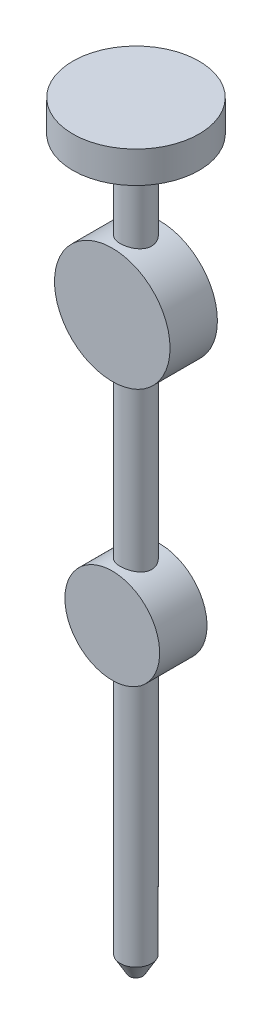
from build123d import *

# Parameters (mm, degrees)
SKETCH_1_R                = 40
EXTRUDE_1_DEPTH           = 20
SKETCH_2_R                = 10
EXTRUDE_2_DEPTH           = 60
EXTRUDE_3_DEPTH           = 15
EXTRUDE_3_DEPTH_BACK      = 15
SKETCH_3_R                = 36.590327892
SKETCH_2_2_R              = 10
EXTRUDE_4_DEPTH           = 450
EXTRUDE_5_DEPTH           = 0.0001
EXTRUDE_5_DEPTH_BACK      = 30
SKETCH_7_R                = 30
SKETCH_8_R                = 10
EXTRUDE_6_DEPTH           = 10
EXTRUDE_6_TAPER           = 30
EXTRUDE_6_OTHER_WAY_DEPTH = 0.0001


with BuildPart() as part:
    # 草图1 → 凸台-拉伸1 (new body)
    with BuildSketch(Plane(origin=(0, 0, 0), x_dir=(1, 0, 0), z_dir=(0, 1, 0))):
        Circle(SKETCH_1_R)
    extrude(amount=EXTRUDE_1_DEPTH)

    # 草图2 → 凸台-拉伸2 (add)
    with BuildSketch(Plane(origin=(0, 0, 0), x_dir=(-1, 0, 0), z_dir=(0, -1, 0))):
        Circle(SKETCH_2_R)
    extrude(amount=EXTRUDE_2_DEPTH)

    # 草图3 → 凸台-拉伸3 (add, two sides: drawn at the far end of the back side and taken through both)
    with BuildSketch(Plane.XY.offset(-EXTRUDE_3_DEPTH_BACK)):
        with Locations((0, -91.676757002)):
            Circle(SKETCH_3_R)
    extrude(amount=EXTRUDE_3_DEPTH + EXTRUDE_3_DEPTH_BACK)

    # 草图2<2> → 凸台-拉伸4 (add)
    with BuildSketch(Plane(origin=(0, 0, 0), x_dir=(-1, 0, 0), z_dir=(0, -1, 0))):
        Circle(SKETCH_2_2_R)
    extrude(amount=EXTRUDE_4_DEPTH)

    # 草图7 → 凸台-拉伸5 (add, two sides: drawn at the far end of the back side and taken through both)
    with BuildSketch(Plane(origin=(0, 0, -15), x_dir=(-1, 0, 0), z_dir=(0, 0, -1)).offset(-EXTRUDE_5_DEPTH_BACK)):
        with Locations((0, -262.19236229)):
            Circle(SKETCH_7_R)
    extrude(amount=EXTRUDE_5_DEPTH + EXTRUDE_5_DEPTH_BACK)

    # 草图8 → 凸台-拉伸6 (add)
    with BuildSketch(Plane.XZ.offset(450)):
        Circle(SKETCH_8_R)
    extrude(amount=EXTRUDE_6_DEPTH, taper=EXTRUDE_6_TAPER)

    # 草图8 → 凸台-拉伸6 other way (add)
    with BuildSketch(Plane.XZ.offset(450)):
        Circle(SKETCH_8_R)
    extrude(amount=-EXTRUDE_6_OTHER_WAY_DEPTH)


solid = part.part
